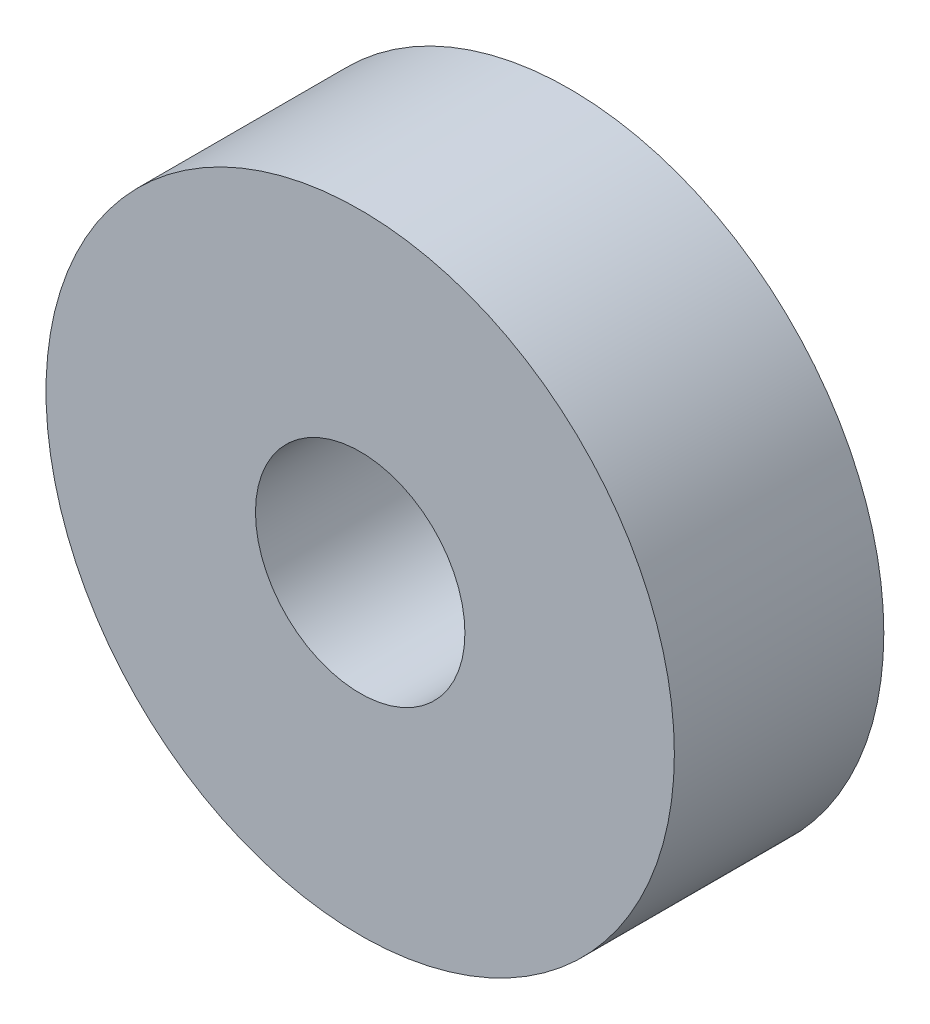
from build123d import *

# Parameters (mm, degrees)
SKETCH2_R           = 6
SKETCH2_R_2         = 2
BOSS_EXTRUDE1_DEPTH = 2


with BuildPart() as part:
    # Sketch2 → Boss-Extrude1 (new, symmetric)
    with BuildSketch(Plane.XY):
        Circle(SKETCH2_R)
        Circle(SKETCH2_R_2, mode=Mode.SUBTRACT)
    extrude(amount=BOSS_EXTRUDE1_DEPTH, both=True)


solid = part.part
